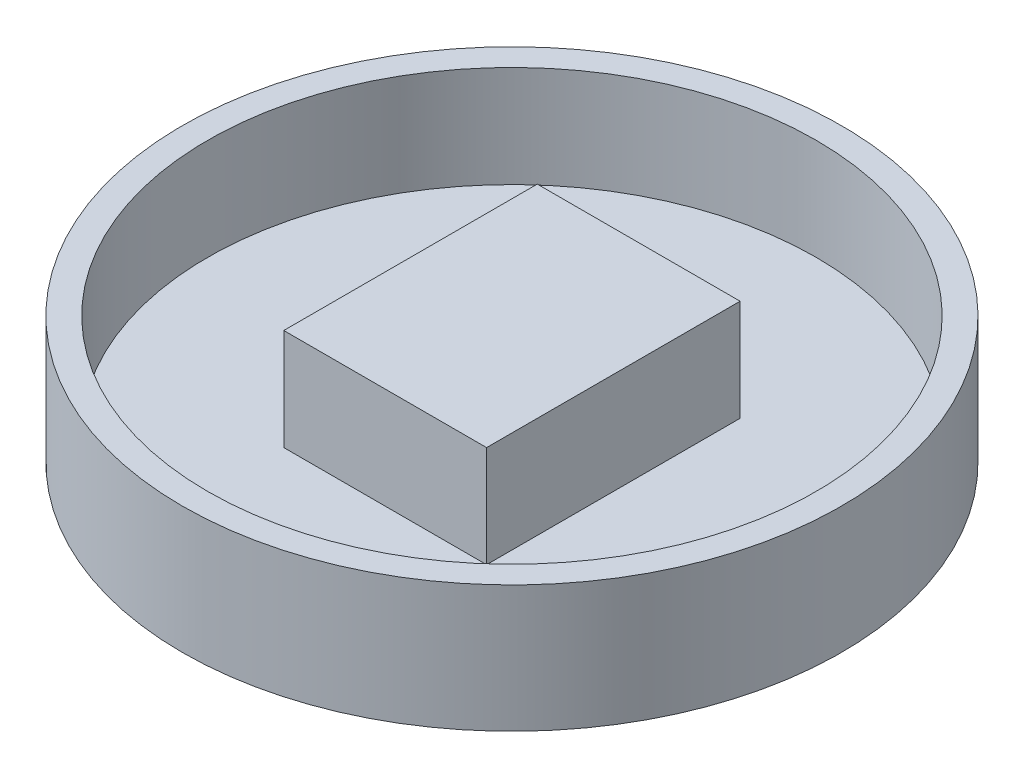
from build123d import *

# Parameters (mm, degrees)
SKETCH1_R           = 65
BOSS_EXTRUDE2_DEPTH = 25
SKETCH2_R           = 60
CUT_EXTRUDE1_DEPTH  = 20
SKETCH3_W           = 40
SKETCH3_H           = 50
BOSS_EXTRUDE3_DEPTH = 20
SKETCH4_W           = 35
SKETCH4_H           = 28
CUT_EXTRUDE2_DEPTH  = 18


with BuildPart() as part:
    # Sketch1 → Boss-Extrude2 (new body)
    with BuildSketch(Plane(origin=(0, 0, 0), x_dir=(1, 0, 0), z_dir=(0, 1, 0))):
        with Locations(Location((0, 0, 0), (0, 0, 270))):
            Circle(SKETCH1_R)
    extrude(amount=BOSS_EXTRUDE2_DEPTH)

    # Sketch2 → Cut-Extrude1 (cut)
    with BuildSketch(Plane(origin=(0, 25, 0), x_dir=(1, 0, 0), z_dir=(0, 1, 0))):
        with Locations(Location((0, 0, 0), (0, 0, 270))):
            Circle(SKETCH2_R)
    extrude(amount=-CUT_EXTRUDE1_DEPTH, mode=Mode.SUBTRACT)

    # Sketch3 → Boss-Extrude3 (add)
    with BuildSketch(Plane(origin=(0, 5, 0), x_dir=(1, 0, 0), z_dir=(0, 1, 0))):
        Rectangle(SKETCH3_W, SKETCH3_H)
    extrude(amount=BOSS_EXTRUDE3_DEPTH)

    # Sketch4 → Cut-Extrude2 (cut)
    with BuildSketch(Plane.XZ):
        with Locations((0, 9)):
            Rectangle(SKETCH4_W, SKETCH4_H)
    extrude(amount=-CUT_EXTRUDE2_DEPTH, mode=Mode.SUBTRACT)


solid = part.part
